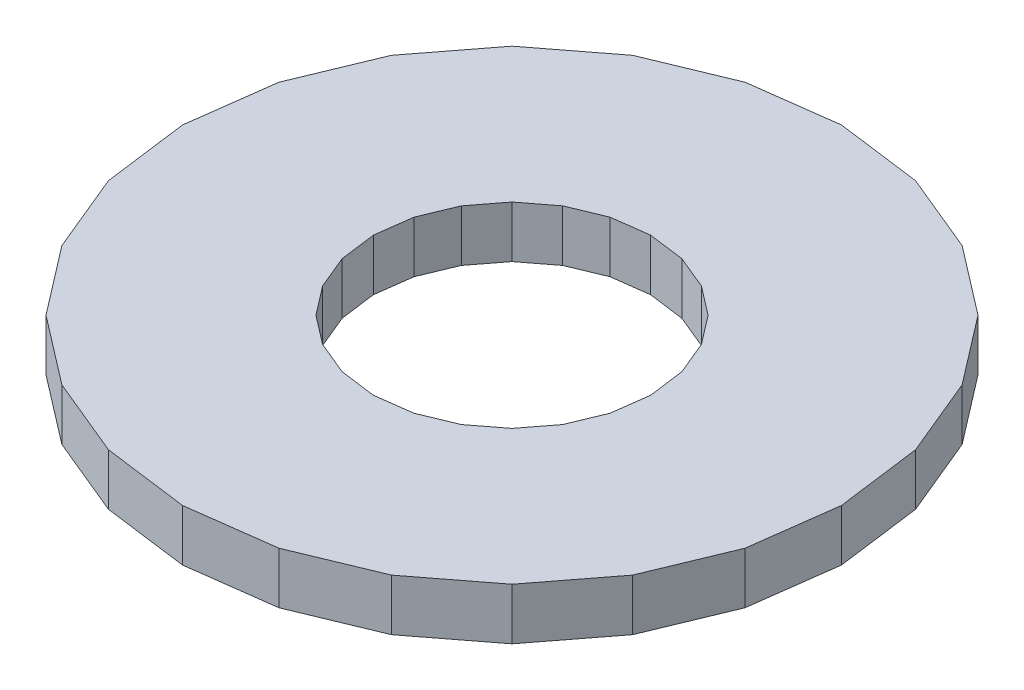
from build123d import *

# Parameters (mm, degrees)
BOSS_EXTRUDE2_DEPTH = 19.05


with BuildPart() as part:
    # Sketch2 → Boss-Extrude2 (new body)
    with BuildSketch(Plane(origin=(0, 0, 0), x_dir=(1, 0, 0), z_dir=(0, 1, 0))):
        Polygon((-121.623099012, 0), (-117.478892409, -31.478374349), (-105.328693431, -60.811549506), (-86.00051806, -86.00051806), (-60.811549506, -105.328693431), (-31.478374349, -117.478892409), (0, -121.623099012), (31.478374349, -117.478892409), (60.811549506, -105.328693431), (86.00051806, -86.00051806), (105.328693431, -60.811549506), (117.478892409, -31.478374349), (121.623099012, 0), (117.478892409, 31.478374349), (105.328693431, 60.811549506), (86.00051806, 86.00051806), (60.811549506, 105.328693431), (31.478374349, 117.478892409), (0, 121.623099012), (-31.478374349, 117.478892409), (-60.811549506, 105.328693431), (-86.00051806, 86.00051806), (-105.328693431, 60.811549506), (-117.478892409, 31.478374349), align=None)
        Polygon((-51.170366115, 0), (-49.426778171, -13.243865295), (-44.314836977, -25.585183058), (-36.182912876, -36.182912876), (-25.585183058, -44.314836977), (-13.243865295, -49.426778171), (0, -51.170366115), (13.243865295, -49.426778171), (25.585183058, -44.314836977), (36.182912876, -36.182912876), (44.314836977, -25.585183058), (49.426778171, -13.243865295), (51.170366115, 0), (49.426778171, 13.243865295), (44.314836977, 25.585183058), (36.182912876, 36.182912876), (25.585183058, 44.314836977), (13.243865295, 49.426778171), (0, 51.170366115), (-13.243865295, 49.426778171), (-25.585183058, 44.314836977), (-36.182912876, 36.182912876), (-44.314836977, 25.585183058), (-49.426778171, 13.243865295), align=None, mode=Mode.SUBTRACT)
    extrude(amount=BOSS_EXTRUDE2_DEPTH)


solid = part.part
